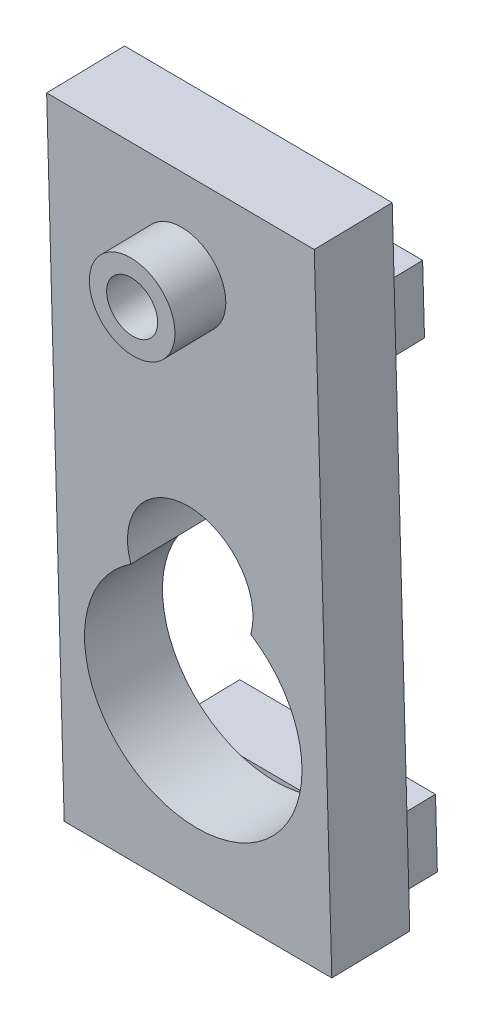
from build123d import *

# Parameters (mm, degrees)
SKETCH_1_W          = 16
SKETCH_1_H          = 38
EXTRUDE_1_DEPTH     = 4.6
CUT_EXTRUDE_3_REACH = 38.941
SKETCH_6_W          = 11.7
SKETCH_6_H          = 4.05
SKETCH_6_R          = 1
EXTRUDE_2_DEPTH     = 3.75
SKETCH_9_R          = 2.56
SKETCH_9_R_2        = 1.525
EXTRUDE_3_DEPTH     = 3
SKETCH_10_R         = 1.45
CUT_EXTRUDE_5_DEPTH = 2.5


with BuildPart() as part:
    # 草图1 → 凸台-拉伸1 (new body)
    with BuildSketch(Plane(origin=(-0.735865771, -2.984459331, 108.825789607), x_dir=(0.9999771565250809, -0.00018529520807729263, 0.006756633311043236), z_dir=(-0.006759173619166435, -0.027413258740008984, 0.9996013339413065))):
        with Locations((-12.117906651, 11.494673284)):
            Rectangle(SKETCH_1_W, SKETCH_1_H)
    extrude(amount=EXTRUDE_1_DEPTH)

    # 草图5 → 切除-拉伸3 (cut, up to next)
    with BuildSketch(Plane(origin=(-0.735865771, -2.984459331, 108.825789607), x_dir=(-0.9999771565250809, 0.0001852952080772962, -0.006756633311043381), z_dir=(0.00675917361916658, 0.02741325874000909, -0.9996013339413065)), mode=Mode.PRIVATE) as cut_extrude_3_sk1:
        with BuildLine():
            ThreePointArc((15.703441088, 8.166291382), (12.117906651, 13.014673284), (8.532372214, 8.166291382))
            ThreePointArc((8.532372214, 8.166291382), (12.117906651, -3.755326716), (15.703441088, 8.166291382))
        make_face()
    cut_extrude_3_tool1 = extrude(cut_extrude_3_sk1.sketch, amount=-CUT_EXTRUDE_3_REACH, mode=Mode.PRIVATE) & part.part
    add(cut_extrude_3_tool1.solids().sort_by_distance((-12.853496, 1.00994, 108.853395))[0], mode=Mode.SUBTRACT)

    # 草图6 → 凸台-拉伸2 (add)
    # profile 1 of 2: a face of its own
    with BuildSketch(Plane(origin=(-0.735865771, -2.984459331, 108.825789607), x_dir=(-0.9999771565250809, 0.0001852952080772936, -0.0067566333110433766), z_dir=(0.006759173619166576, 0.02741325874000879, -0.9996013339413065))):
        with Locations((12.117906651, 22.369673284)):
            Rectangle(SKETCH_6_W, SKETCH_6_H)
        with Locations(Location((12.117906651, 21.944673284, 0), (0, 0, 270))):
            Circle(SKETCH_6_R, mode=Mode.SUBTRACT)
    # profile 2 of 2: a face of its own
    with BuildSketch(Plane(origin=(-0.735865771, -2.984459331, 108.825789607), x_dir=(-0.9999771565250809, 0.0001852952080772936, -0.0067566333110433766), z_dir=(0.006759173619166576, 0.02741325874000879, -0.9996013339413065))):
        Polygon((7.267906651, -3.455326716), (17.967906651, -3.455326716), (17.967906651, -7.505326716), (6.267906651, -7.505326716), (6.267906651, -3.455326716), align=None)
        with Locations(Location((12.117906651, -5.055326716, 0), (0, 0, 270))):
            Circle(SKETCH_6_R, mode=Mode.SUBTRACT)
    extrude(amount=EXTRUDE_2_DEPTH)

    # 草图9 → 凸台-拉伸3 (add)
    with BuildSketch(Plane(origin=(-0.76695797, -3.110560321, 113.423955744), x_dir=(0.9999771565250809, -0.00018529520807729366, 0.006756633311043378), z_dir=(-0.006759173619166578, -0.02741325874000878, 0.9996013339413065))):
        with Locations(Location((-12.117906651, 25.004673284, 0), (0, 0, 90))):
            Circle(SKETCH_9_R)
        with Locations(Location((-12.117906651, 25.004673284, 0), (0, 0, 90))):
            Circle(SKETCH_9_R_2, mode=Mode.SUBTRACT)
    extrude(amount=EXTRUDE_3_DEPTH)

    # 草图10 → 切除-拉伸5 (cut)
    with BuildSketch(Plane(origin=(-0.76695797, -3.110560321, 113.423955744), x_dir=(0.9999771565250809, -0.00018529520807729366, 0.006756633311043378), z_dir=(-0.006759173619166578, -0.02741325874000879, 0.9996013339413065))):
        with Locations(Location((-12.117906651, 25.004673284, 0), (0, 0, 270))):
            Circle(SKETCH_10_R)
    extrude(amount=-CUT_EXTRUDE_5_DEPTH, mode=Mode.SUBTRACT)


solid = part.part
